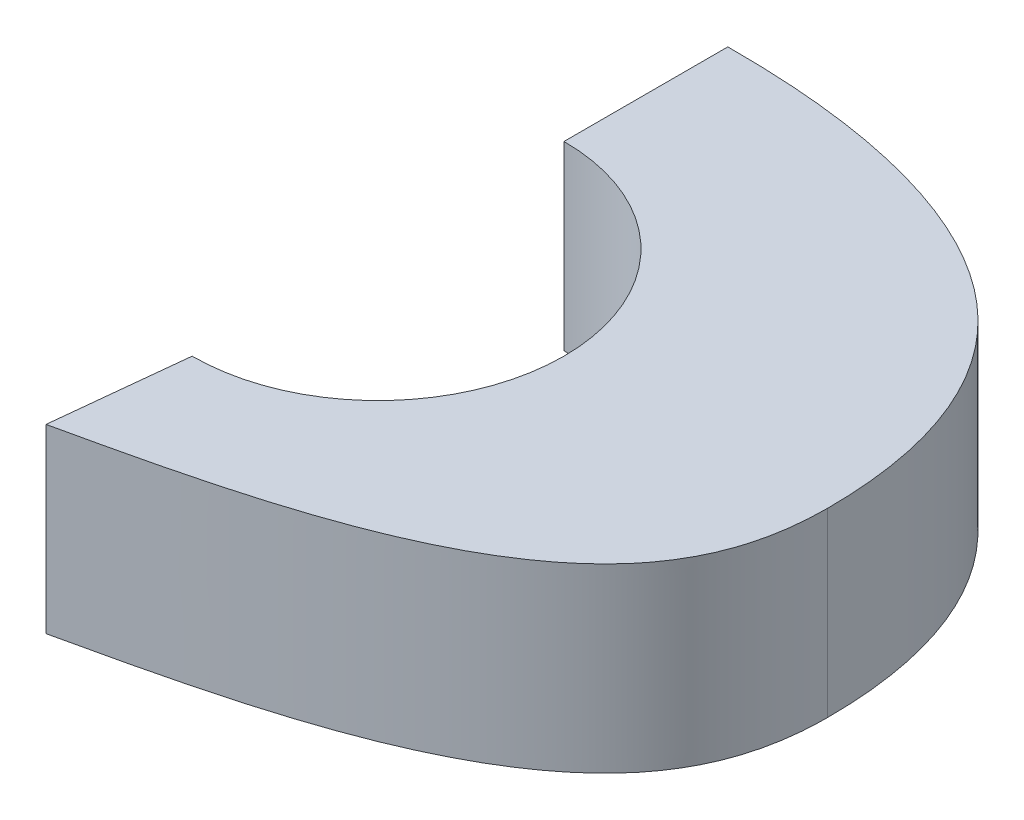
from build123d import *

# Parameters (mm, degrees)
BOSS_EXTRUDE1_DEPTH = 10
SKETCH5_W           = 190.665965361
SKETCH5_H           = 98.914857752
CUT_EXTRUDE2_DEPTH  = 131.512395512
SKETCH3_W           = 191.984120241
SKETCH3_H           = 92.475390347
CUT_EXTRUDE1_DEPTH  = 125.356356188


with BuildPart() as part:
    # Sketch2 → Boss-Extrude1 (new body)
    with BuildSketch(Plane(origin=(0, 0, 0), x_dir=(1, 0, 0), z_dir=(0, 1, 0))):
        with BuildLine():
            Line((-26, 24.3), (0, 24.3))
            add(Edge.make_bspline(
                [(0, 24.3), (20.683832289, 24.384713811), (29.8, 14.098961604), (29.8, 0)],
                knots=[0, 0, 0, 0, 1, 1, 1, 1], degree=3))
            add(Edge.make_bspline(
                [(29.8, 0), (29.8, -15.903385672), (12.793782652, -19.673675204), (0, -22.5)],
                knots=[0, 0, 0, 0, 1, 1, 1, 1], degree=3))
            add(Edge.make_bspline(
                [(-86.5, -27.9), (-58.742591927, -27.9), (0, -22.5)],
                knots=[0, 0, 0, 1, 1, 1], degree=2))
            add(Edge.make_bspline(
                [(-124.6, 11.6), (-126.645501882, -15.929564791), (-96.169164371, -28.458925346), (-86.5, -27.9)],
                knots=[0, 0, 0, 0, 1, 1, 1, 1], degree=3))
            add(Edge.make_bspline(
                [(-86.5, 37.2), (-111.583343569, 37.2), (-124.6, 21.145918181), (-124.6, 11.6)],
                knots=[0, 0, 0, 0, 1, 1, 1, 1], degree=3))
            add(Edge.make_bspline(
                [(-26, 24.3), (-46.37360759, 24.3), (-60.223367409, 37.2), (-86.5, 37.2)],
                knots=[0, 0, 0, 0, 1, 1, 1, 1], degree=3))
        make_face()
    extrude(amount=BOSS_EXTRUDE1_DEPTH)

    # Sketch5 → Cut-Extrude2 (cut, through all)
    with BuildSketch(Plane(origin=(0, 10, 0), x_dir=(1, 0, 0), z_dir=(0, 1, 0))):
        with Locations((-37.807166851, 5.712427693)):
            Rectangle(SKETCH5_W, SKETCH5_H)
        with BuildLine():
            Line((0, 19.3), (-26, 19.3))
            add(Edge.make_bspline(
                [(-26, 19.3), (-28.614389566, 19.3), (-31.195480065, 19.494126305), (-36.299918034, 20.219008193), (-38.823236595, 20.749932309), (-43.82844627, 22.053293526), (-46.31311575, 22.826190042), (-51.244397222, 24.470393512), (-53.69402913, 25.341112046), (-58.607069123, 27.040712597), (-61.070722849, 27.868848632), (-64.806301572, 28.989279687), (-66.059451522, 29.343006622), (-68.572193461, 29.996166113), (-69.832412317, 30.295833479), (-73.626302931, 31.102275727), (-76.173387066, 31.51524352), (-81.307214737, 32.063798503), (-83.893870441, 32.2), (-86.5, 32.2)],
                knots=[0, 0, 0, 0, 0.125, 0.125, 0.25, 0.25, 0.375, 0.375, 0.5, 0.5, 0.625, 0.625, 0.6875, 0.6875, 0.75, 0.75, 0.875, 0.875, 1, 1, 1, 1], degree=3))
            add(Edge.make_bspline(
                [(-86.5, 32.2), (-90.047671723, 32.2), (-93.539315109, 31.853363621), (-97.818101716, 30.88944061), (-98.669522164, 30.669824618), (-100.363040922, 30.17291839), (-101.207876089, 29.89460231), (-103.707194596, 28.9730152), (-105.314538731, 28.24898707), (-108.402461221, 26.564840966), (-109.885156962, 25.604040465), (-112.695415045, 23.412360835), (-113.989352092, 22.209304545), (-115.736354807, 20.217749989), (-116.286105675, 19.522480074), (-117.307591473, 18.056713662), (-117.771937921, 17.297113036), (-118.380597746, 16.112260348), (-118.568848857, 15.709499136), (-118.910400222, 14.885324985), (-119.063856456, 14.46298862), (-119.32099023, 13.612441675), (-119.425833719, 13.182501201), (-119.534502641, 12.528030347), (-119.56255262, 12.308265558), (-119.588853411, 11.975515189), (-119.594973106, 11.86407762), (-119.600932982, 11.639967141), (-119.6, 11.527142129), (-119.6, 11.414500659)],
                knots=[0, 0, 0, 0, 0.25, 0.25, 0.3125, 0.3125, 0.375, 0.375, 0.5, 0.5, 0.625, 0.625, 0.75, 0.75, 0.8125, 0.8125, 0.875, 0.875, 0.90625, 0.90625, 0.9375, 0.9375, 0.96875, 0.96875, 0.984375, 0.984375, 0.9921875, 0.9921875, 1, 1, 1, 1], degree=3))
            add(Edge.make_bspline(
                [(-119.6, 11.414500659), (-119.620469876, 11.139005048), (-119.640012507, 10.863585734), (-119.66949801, 10.313536999), (-119.702590259, 9.489380197), (-119.701746238, 8.668015761), (-119.653311171, 7.029133356), (-119.558725583, 5.941670929), (-119.316814989, 4.318708201), (-119.219497862, 3.779093122), (-118.990298597, 2.702707063), (-118.857842254, 2.164001324), (-118.411370332, 0.568296748), (-118.049576648, -0.466050211), (-117.204822005, -2.479103419), (-116.721870667, -3.457814087), (-115.911016092, -4.886192051), (-115.626316263, -5.355698602), (-115.028686616, -6.281748331), (-114.715117794, -6.739029825), (-113.098128241, -8.967198862), (-111.636582687, -10.586754888), (-109.243370012, -12.821144966), (-108.411754958, -13.533067597), (-107.116844881, -14.554870601), (-106.676456633, -14.888333255), (-105.787025552, -15.535321816), (-105.337421344, -15.84934205), (-103.066112758, -17.374312871), (-101.175798147, -18.452299517), (-98.237583629, -19.870168351), (-97.240844592, -20.309198302), (-95.209999189, -21.114841784), (-94.174615133, -21.48224539), (-92.064314636, -22.126795927), (-91.001033475, -22.402007075), (-89.387886633, -22.70933152), (-88.84713932, -22.794224632), (-88.028751145, -22.879499568), (-87.754740398, -22.90089357), (-87.340882626, -22.916536257), (-87.202453029, -22.918989427), (-86.924204685, -22.915854968), (-86.784006393, -22.908070411), (-86.64375233, -22.899963035)],
                knots=[0, 0, 0, 0, 0.015625, 0.015625, 0.03125, 0.0625, 0.0625, 0.125, 0.125, 0.15625, 0.15625, 0.1875, 0.1875, 0.25, 0.25, 0.3125, 0.3125, 0.34375, 0.34375, 0.375, 0.375, 0.5, 0.5, 0.5625, 0.5625, 0.59375, 0.59375, 0.625, 0.625, 0.75, 0.75, 0.8125, 0.8125, 0.875, 0.875, 0.9375, 0.9375, 0.96875, 0.96875, 0.984375, 0.984375, 0.9921875, 0.9921875, 1, 1, 1, 1], degree=3))
            add(Edge.make_bspline(
                [(-86.64375233, -22.899963035), (-83.051721737, -22.901813131), (-79.463866007, -22.836654879), (-72.292852573, -22.630933055), (-68.709770334, -22.489158228), (-57.965349536, -21.986375675), (-50.808741052, -21.549448214), (-36.50252062, -20.563295893), (-29.353030187, -20.012120654), (-15.058799553, -18.833526914), (-7.914092044, -18.205583695), (-0.771119947, -17.549786375)],
                knots=[0, 0, 0, 0, 0.125, 0.125, 0.25, 0.25, 0.5, 0.5, 0.75, 0.75, 1, 1, 1, 1], degree=3))
            add(Edge.make_bspline(
                [(-0.771119947, -17.549786375), (1.963321139, -16.94544861), (4.695341149, -16.33357579), (8.730024902, -15.218615637), (10.064478195, -14.814466089), (12.699729823, -13.90142355), (14.000796007, -13.393364173), (15.911888282, -12.505206219), (16.542091865, -12.187905528), (17.784402153, -11.496981701), (18.391917697, -11.125662576), (19.559410174, -10.32463286), (20.121164342, -9.894098151), (20.920538613, -9.18924898), (21.180682911, -8.943393186), (21.678462153, -8.434660622), (21.916135354, -8.171907904), (22.59259098, -7.356311131), (22.994745994, -6.776081028), (23.513123046, -5.842290056), (23.671822244, -5.519779327), (23.953566298, -4.86813842), (24.077688222, -4.537273262), (24.402854637, -3.53046254), (24.556745878, -2.840315617), (24.755950633, -1.42732092), (24.8, -0.714331591), (24.8, 0)],
                knots=[0, 0, 0, 0, 0.25, 0.25, 0.375, 0.375, 0.5, 0.5, 0.5625, 0.5625, 0.625, 0.625, 0.6875, 0.6875, 0.71875, 0.71875, 0.75, 0.75, 0.8125, 0.8125, 0.84375, 0.84375, 0.875, 0.875, 0.9375, 0.9375, 1, 1, 1, 1], degree=3))
            add(Edge.make_bspline(
                [(24.8, 0), (24.800001574, 1.499794527), (24.679867583, 2.978315628), (24.270262238, 5.1554747), (24.095205029, 5.874372955), (23.764785291, 6.940708409), (23.64330548, 7.294145508), (23.375491288, 7.996618496), (23.229208001, 8.345127218), (22.758435322, 9.365838107), (22.399931747, 10.019031745), (21.589242675, 11.268187742), (21.136243882, 11.865038785), (19.63468306, 13.559968632), (18.489202915, 14.513686307), (16.909680401, 15.525653475), (16.58535259, 15.719500417), (15.929822317, 16.085938782), (15.598164332, 16.258912353), (14.592578593, 16.74990385), (13.908081512, 17.040104299), (12.515293354, 17.557881638), (11.806985872, 17.785415353), (10.369782811, 18.186296846), (9.638661479, 18.360025682), (7.436633609, 18.806009812), (5.959001697, 19.004489088), (2.98950105, 19.255065786), (1.497532001, 19.3061318), (0, 19.3)],
                knots=[0, 0, 0, 0, 0.125, 0.125, 0.1875, 0.1875, 0.21875, 0.21875, 0.25, 0.25, 0.3125, 0.3125, 0.375, 0.375, 0.5, 0.5, 0.53125, 0.53125, 0.5625, 0.5625, 0.625, 0.625, 0.6875, 0.6875, 0.75, 0.75, 0.875, 0.875, 1, 1, 1, 1], degree=3))
        make_face(mode=Mode.SUBTRACT)
    extrude(amount=-CUT_EXTRUDE2_DEPTH, mode=Mode.SUBTRACT)

    # Sketch3 → Cut-Extrude1 (cut, through all)
    with BuildSketch(Plane(origin=(0, 10, 0), x_dir=(1, 0, 0), z_dir=(0, 1, 0))):
        with Locations((-40.989040218, 1.022012658)):
            Rectangle(SKETCH3_W, SKETCH3_H)
        with BuildLine():
            Line((0, 19.3), (0, 10.258653745))
            ThreePointArc((0, 10.258653745), (10.258653745, 0), (0, -10.258653745))
            Line((0, -10.258653745), (-0.771119947, -17.549786375))
            add(Edge.make_bspline(
                [(-0.771119947, -17.549786375), (1.963321139, -16.94544861), (4.695341149, -16.33357579), (8.730024902, -15.218615637), (10.064478195, -14.814466089), (12.699729823, -13.90142355), (14.000796007, -13.393364173), (15.911888282, -12.505206219), (16.542091865, -12.187905528), (17.784402153, -11.496981701), (18.391917697, -11.125662576), (19.559410174, -10.32463286), (20.121164342, -9.894098151), (20.920538613, -9.18924898), (21.180682911, -8.943393186), (21.678462153, -8.434660622), (21.916135354, -8.171907904), (22.59259098, -7.356311131), (22.994745994, -6.776081028), (23.513123046, -5.842290056), (23.671822244, -5.519779327), (23.953566298, -4.86813842), (24.077688222, -4.537273262), (24.402854637, -3.53046254), (24.556745878, -2.840315617), (24.755950633, -1.42732092), (24.8, -0.714331591), (24.8, 0)],
                knots=[0, 0, 0, 0, 0.25, 0.25, 0.375, 0.375, 0.5, 0.5, 0.5625, 0.5625, 0.625, 0.625, 0.6875, 0.6875, 0.71875, 0.71875, 0.75, 0.75, 0.8125, 0.8125, 0.84375, 0.84375, 0.875, 0.875, 0.9375, 0.9375, 1, 1, 1, 1], degree=3))
            add(Edge.make_bspline(
                [(24.8, 0), (24.800001574, 1.499794527), (24.679867583, 2.978315628), (24.270262238, 5.1554747), (24.095205029, 5.874372955), (23.764785291, 6.940708409), (23.64330548, 7.294145508), (23.375491288, 7.996618496), (23.229208001, 8.345127218), (22.758435322, 9.365838107), (22.399931747, 10.019031745), (21.589242675, 11.268187742), (21.136243882, 11.865038785), (19.63468306, 13.559968632), (18.489202915, 14.513686307), (16.909680401, 15.525653475), (16.58535259, 15.719500417), (15.929822317, 16.085938782), (15.598164332, 16.258912353), (14.592578593, 16.74990385), (13.908081512, 17.040104299), (12.515293354, 17.557881638), (11.806985872, 17.785415353), (10.369782811, 18.186296846), (9.638661479, 18.360025682), (7.436633609, 18.806009812), (5.959001697, 19.004489088), (2.98950105, 19.255065786), (1.497532001, 19.3061318), (0, 19.3)],
                knots=[0, 0, 0, 0, 0.125, 0.125, 0.1875, 0.1875, 0.21875, 0.21875, 0.25, 0.25, 0.3125, 0.3125, 0.375, 0.375, 0.5, 0.5, 0.53125, 0.53125, 0.5625, 0.5625, 0.625, 0.625, 0.6875, 0.6875, 0.75, 0.75, 0.875, 0.875, 1, 1, 1, 1], degree=3))
        make_face(mode=Mode.SUBTRACT)
    extrude(amount=-CUT_EXTRUDE1_DEPTH, mode=Mode.SUBTRACT)


solid = part.part
